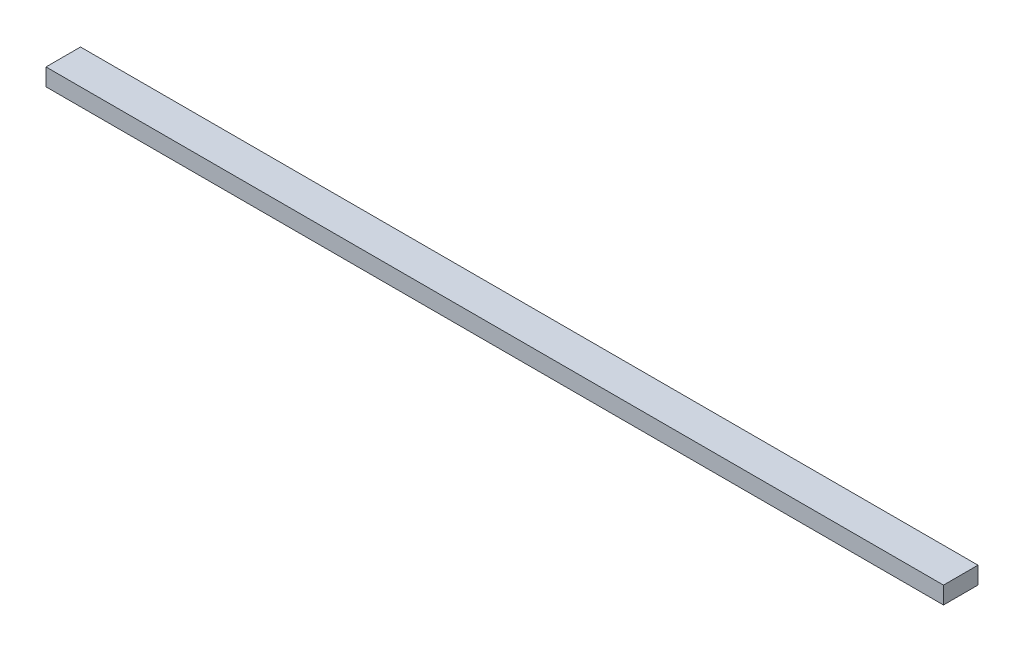
from build123d import *

# Parameters (mm, degrees)
CROQUIS1_W              = 1300
CROQUIS1_H              = 50
SALIENTE_EXTRUIR1_DEPTH = 25


with BuildPart() as part:
    # Croquis1 → Saliente-Extruir1 (new body)
    with BuildSketch(Plane(origin=(0, 0, 0), x_dir=(1, 0, 0), z_dir=(0, 1, 0))):
        with Locations((-480.904116403, -75)):
            Rectangle(CROQUIS1_W, CROQUIS1_H)
    extrude(amount=SALIENTE_EXTRUIR1_DEPTH)


solid = part.part
